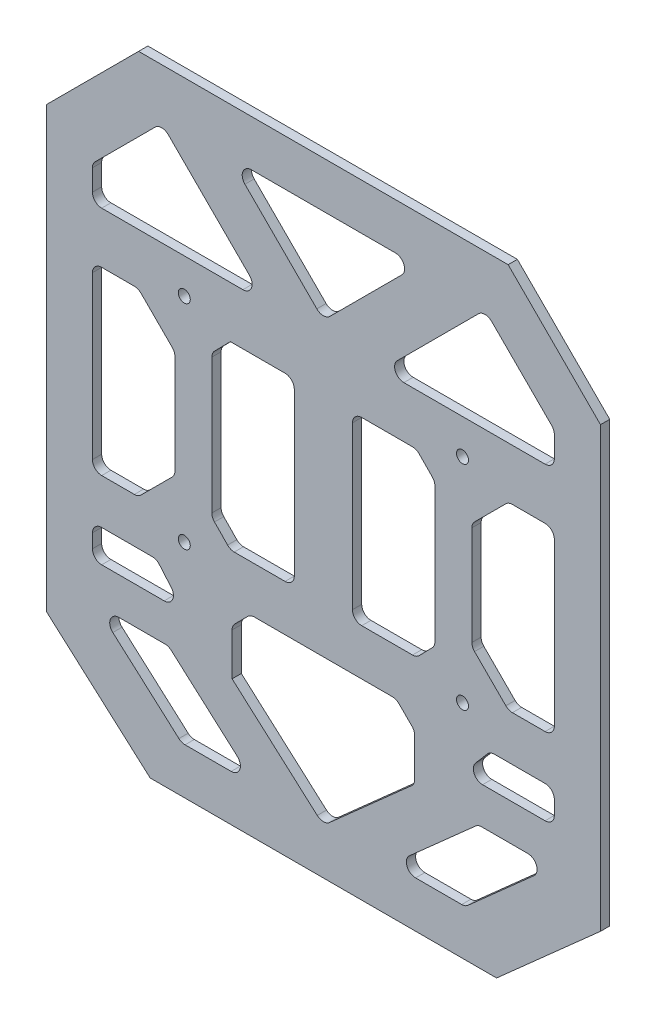
from build123d import *

# Parameters (mm, degrees)
BOSS_EXTRUDE1_DEPTH = 1.27
BOSS_EXTRUDE2_DEPTH = 2.54
SKETCH3_W           = 55.501519427
SKETCH3_H           = 49.578797493
CUT_EXTRUDE1_DEPTH  = 2.54
BOSS_EXTRUDE3_DEPTH = 2.54
BOSS_EXTRUDE4_DEPTH = 2.54
SKETCH6_R           = 1.65
CUT_EXTRUDE2_DEPTH  = 2.54
CHAMFER1_SIZE       = 5.08
FILLET1_R           = 2.54
FILLET2_R           = 2.54


with BuildPart() as part:
    # Sketch1 → Boss-Extrude1 (new, symmetric)
    with BuildSketch(Plane.XY):
        Polygon((-76.2, 60.325), (-76.2, -60.325), (76.2, -60.325), (76.2, 60.325), (50.8, 85.725), (-50.8, 85.725), align=None)
    extrude(amount=BOSS_EXTRUDE1_DEPTH, both=True)

    # Sketch2 → Boss-Extrude2 (add)
    with BuildSketch(Plane.XY.offset(1.27)):
        Polygon((-47.625, -85.725), (47.625, -85.725), (76.2, -60.325), (-76.2, -60.325), align=None)
    extrude(amount=-BOSS_EXTRUDE2_DEPTH)

    # Sketch3 → Cut-Extrude1 (cut)
    with BuildSketch(Plane.XY.offset(1.27)):
        Polygon((-25.107219952, -50.848797493), (-25.107219952, -33.068797493), (25.107219952, -33.068797493), (25.107219952, -50.848797493), (0, -73.166326339), align=None)
        Polygon((-62.895047936, -51.78188729), (-42.575047936, -51.78188729), (-18.676546137, -73.025), (-38.996546137, -73.025), align=None)
        Polygon((-25.913038854, 73.025), (25.913038854, 73.025), (0, 47.111961146), align=None)
        Polygon((18.676546137, -73.025), (38.996546137, -73.025), (62.895047936, -51.78188729), (42.575047936, -51.78188729), align=None)
        Polygon((-44.45, 71.755), (-63.5, 52.705), (-63.5, 43.301961146), (-15.996961146, 43.301961146), align=None)
        Polygon((44.45, 71.755), (63.5, 52.705), (63.5, 43.301961146), (15.996961146, 43.301961146), align=None)
        with Locations((-35.749240287, 4.420601253)):
            Rectangle(SKETCH3_W, SKETCH3_H)
        with Locations((35.749240287, 4.420601253)):
            Rectangle(SKETCH3_W, SKETCH3_H)
    extrude(amount=-CUT_EXTRUDE1_DEPTH, mode=Mode.SUBTRACT)

    # Sketch4 → Boss-Extrude3 (add)
    with BuildSketch(Plane.XY.offset(1.27)):
        Polygon((40.826553226, 29.21), (30.666553226, 29.21), (30.666553226, 24.01714149), (30.666553226, -15.175938983), (30.666553226, -20.368797493), (40.826553226, -20.368797493), (40.826553226, -12.82106127), (40.826553226, 21.662263777), align=None)
        Polygon((30.666553226, 24.01714149), (30.666553226, 29.21), (25.586553226, 29.21), align=None)
        Polygon((48.374289449, 29.21), (40.826553226, 29.21), (40.826553226, 21.662263777), align=None)
        Polygon((30.666553226, -20.368797493), (30.666553226, -15.175938983), (25.586553226, -20.368797493), align=None)
        Polygon((48.374289449, -20.368797493), (40.826553226, -12.82106127), (40.826553226, -20.368797493), align=None)
        Polygon((-25.586553226, 29.21), (-30.666553226, 29.21), (-30.666553226, 24.01714149), align=None)
        Polygon((-30.666553226, 24.01714149), (-30.666553226, 29.21), (-40.826553226, 29.21), (-40.826553226, 21.662263777), (-40.826553226, -12.82106127), (-40.826553226, -20.368797493), (-30.666553226, -20.368797493), (-30.666553226, -15.175938983), align=None)
        Polygon((-40.826553226, 21.662263777), (-40.826553226, 29.21), (-48.374289449, 29.21), align=None)
        Polygon((-25.586553226, -20.368797493), (-30.666553226, -15.175938983), (-30.666553226, -20.368797493), align=None)
        Polygon((-40.826553226, -20.368797493), (-40.826553226, -12.82106127), (-48.374289449, -20.368797493), align=None)
    extrude(amount=-BOSS_EXTRUDE3_DEPTH)

    # Sketch5 → Boss-Extrude4 (add)
    with BuildSketch(Plane.XY.offset(1.27)):
        Polygon((-40.826553226, 21.662263777), (-40.826553226, 19.122263777), (-50.914289449, 29.21), (-48.374289449, 29.21), align=None)
        Polygon((-48.374289449, -20.368797493), (-50.914289449, -20.368797493), (-40.826553226, -10.28106127), (-40.826553226, -12.82106127), align=None)
        Polygon((48.374289449, -20.368797493), (40.826553226, -12.82106127), (40.826553226, -10.28106127), (50.914289449, -20.368797493), align=None)
        Polygon((48.374289449, 29.21), (50.914289449, 29.21), (40.826553226, 19.122263777), (40.826553226, 21.662263777), align=None)
    extrude(amount=-BOSS_EXTRUDE4_DEPTH)

    # Sketch6 → Cut-Extrude2 (cut)
    with BuildSketch(Plane.XY.offset(1.27)):
        with Locations((38.250421337, 33.717772659)):
            Circle(SKETCH6_R)
        with Locations(Location((38.250421337, -24.876570152, 0), (0, 0, 180))):
            Circle(SKETCH6_R)
        with Locations((-38.250421337, -24.876570152)):
            Circle(SKETCH6_R)
        with Locations(Location((-38.250421337, 33.717772659, 0), (0, 0, 180))):
            Circle(SKETCH6_R)
        Polygon((45.870421337, -41.62188729), (63.5, -41.62188729), (63.5, -32.73188729), (45.870421337, -32.73188729), (38.250421337, -41.62188729), align=None)
        Polygon((-63.5, -41.62188729), (-63.5, -32.73188729), (-45.870421337, -32.73188729), (-38.250421337, -41.62188729), (-45.870421337, -41.62188729), align=None)
    extrude(amount=-CUT_EXTRUDE2_DEPTH, mode=Mode.SUBTRACT)

    # Chamfer1
    chamfer1_edges = [part.edges().sort_by_distance(p)[0] for p in [
        (-25.107219952, -33.068797493, 0),
        (25.107219952, -33.068797493, 0),
    ]]
    chamfer(chamfer1_edges, length=CHAMFER1_SIZE)

    # Fillet1
    fillet1_edges = [part.edges().sort_by_distance(p)[0] for p in [
        (25.107219952, -50.848797493, 0),
        (0, -73.166326339, 0),
        (38.250421337, -41.62188729, 0),
        (45.870421337, -32.73188729, 0),
        (63.5, -32.73188729, 0),
        (63.5, -41.62188729, 0),
        (-63.5, -41.62188729, 0),
        (-63.5, -32.73188729, 0),
        (-45.870421337, -32.73188729, 0),
        (-38.250421337, -41.62188729, 0),
        (-20.027219952, -33.068797493, 0),
        (20.027219952, -33.068797493, 0),
        (25.107219952, -38.148797493, 0),
        (-25.107219952, -38.148797493, 0),
        (-38.996546137, -73.025, 0),
        (-62.895047936, -51.78188729, 0),
        (-42.575047936, -51.78188729, 0),
        (-18.676546137, -73.025, 0),
        (18.676546137, -73.025, 0),
        (42.575047936, -51.78188729, 0),
        (62.895047936, -51.78188729, 0),
        (38.996546137, -73.025, 0),
    ]]
    fillet(fillet1_edges, radius=FILLET1_R)

    # Fillet2
    fillet2_edges = [part.edges().sort_by_distance(p)[0] for p in [
        (-44.45, 71.755, 0),
        (-15.996961146, 43.301961146, 0),
        (-63.5, 43.301961146, 0),
        (-63.5, 52.705, 0),
        (15.996961146, 43.301961146, 0),
        (44.45, 71.755, 0),
        (63.5, 52.705, 0),
        (63.5, 43.301961146, 0),
        (7.998480573, 29.21, 0),
        (63.5, 29.21, 0),
        (63.5, -20.368797493, 0),
        (7.998480573, -20.368797493, 0),
        (25.586553226, 29.21, 0),
        (30.666553226, -15.175938983, 0),
        (30.666553226, 24.01714149, 0),
        (25.586553226, -20.368797493, 0),
        (-25.586553226, -20.368797493, 0),
        (-30.666553226, -15.175938983, 0),
        (-30.666553226, 24.01714149, 0),
        (-50.914289449, -20.368797493, 0),
        (-40.826553226, -10.28106127, 0),
        (50.914289449, 29.21, 0),
        (40.826553226, 19.122263777, 0),
        (50.914289449, -20.368797493, 0),
        (40.826553226, -10.28106127, 0),
        (-50.914289449, 29.21, 0),
        (-40.826553226, 19.122263777, 0),
        (-7.998480573, -20.368797493, 0),
        (-63.5, -20.368797493, 0),
        (-63.5, 29.21, 0),
        (-7.998480573, 29.21, 0),
        (25.913038854, 73.025, 0),
        (0, 47.111961146, 0),
        (-25.913038854, 73.025, 0),
    ]]
    fillet(fillet2_edges, radius=FILLET2_R)


solid = part.part
